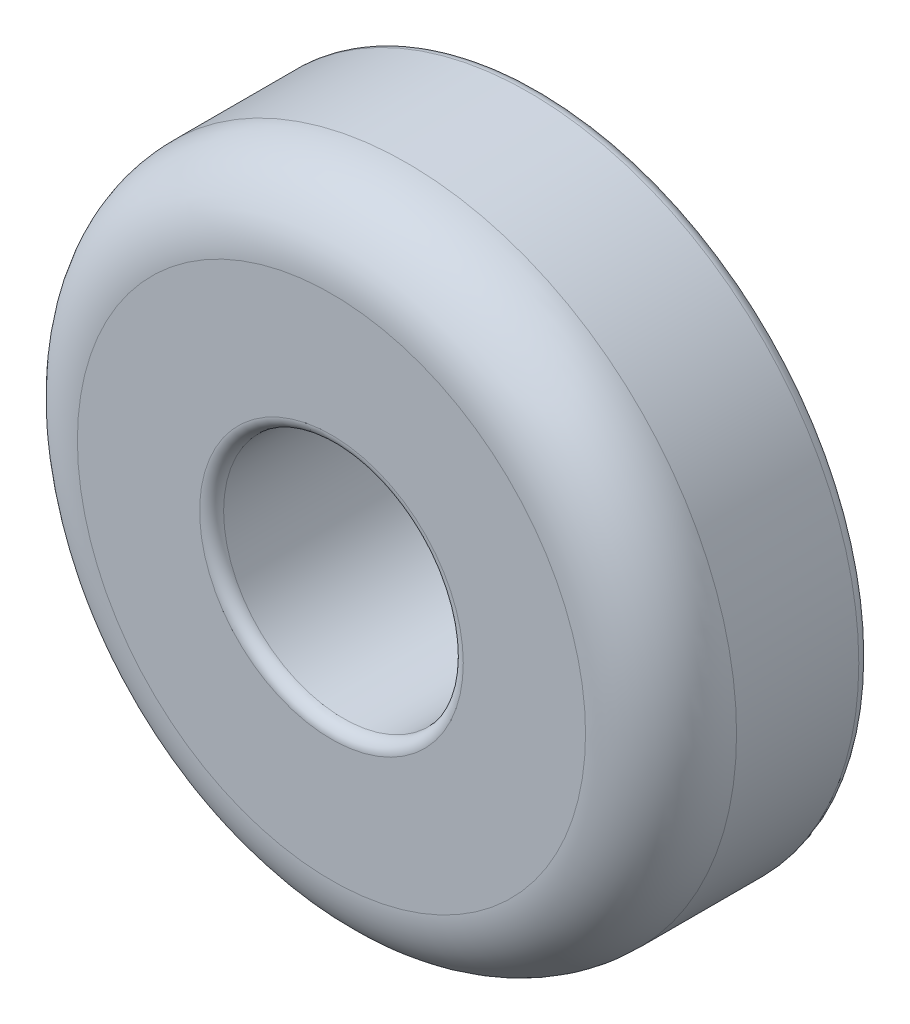
from build123d import *

# Parameters (mm, degrees)
SKETCH1_R           = 2.75
SKETCH1_R_2         = 1
EXTRUDE_THIN1_DEPTH = 1.75
FILLET1_R           = 0.1
FILLET2_R           = 0.63


with BuildPart() as part:
    # Sketch1 → Extrude-Thin1 (new body)
    with BuildSketch(Plane.XY):
        Circle(SKETCH1_R)
        Circle(SKETCH1_R_2, mode=Mode.SUBTRACT)
    extrude(amount=EXTRUDE_THIN1_DEPTH)

    # Fillet1
    fillet1_edges = [part.edges().sort_by_distance(p)[0] for p in [
        (-2.75, 0, 0),
        (-1, 0, 0),
        (-1, 0, 1.75),
    ]]
    fillet(fillet1_edges, radius=FILLET1_R)

    # Fillet2
    fillet2_edges = [part.edges().sort_by_distance(p)[0] for p in [
        (-2.75, 0, 1.75),
    ]]
    fillet(fillet2_edges, radius=FILLET2_R)


solid = part.part
